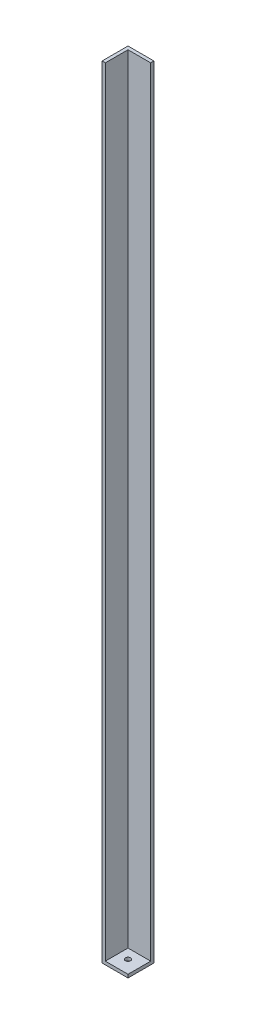
from build123d import *

# Parameters (mm, degrees)
SKETCH_1_W          = 40
SKETCH_1_H          = 40
EXTRUDE_1_DEPTH     = 5
SKETCH_2_R          = 4.05
CUT_EXTRUDE_1_DEPTH = 5
EXTRUDE_2_DEPTH     = 600


with BuildPart() as part:
    # 草图1 → 凸台-拉伸1 (new body)
    with BuildSketch(Plane(origin=(0, 0, 0), x_dir=(1, 0, 0), z_dir=(0, 1, 0))):
        Rectangle(SKETCH_1_W, SKETCH_1_H)
    extrude(amount=EXTRUDE_1_DEPTH)

    # 草图2 → 切除-拉伸1 (cut)
    with BuildSketch(Plane(origin=(0, 5, 0), x_dir=(1, 0, 0), z_dir=(0, 1, 0))):
        with Locations(Location((0, 0, 0), (0, 0, 270))):
            Circle(SKETCH_2_R)
    extrude(amount=-CUT_EXTRUDE_1_DEPTH, mode=Mode.SUBTRACT)

    # 草图3 → 凸台-拉伸2 (add)
    with BuildSketch(Plane(origin=(0, 5, 0), x_dir=(1, 0, 0), z_dir=(0, 1, 0))):
        Polygon((-20, 20), (-20, -20), (-15, -20), (-15, 15), (20, 15), (20, 20), align=None)
    extrude_2 = extrude(amount=EXTRUDE_2_DEPTH)

    # 镜向1: 凸台-拉伸2 across plane
    add(extrude_2.mirror(Plane.ZX.offset(605)))


solid = part.part
